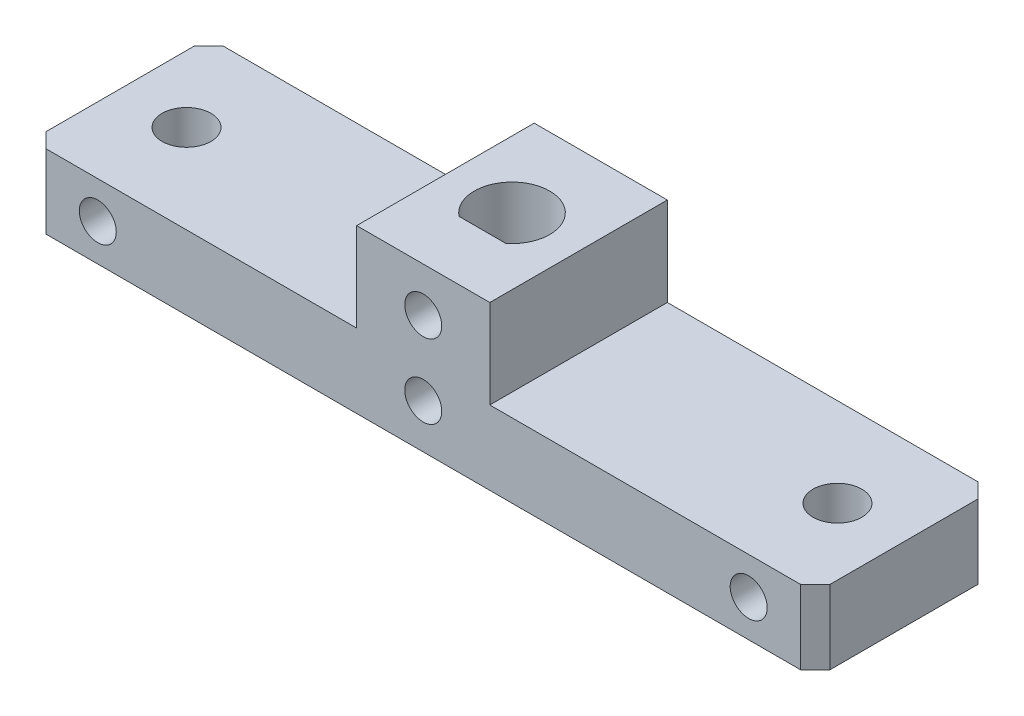
from build123d import *

# Parameters (mm, degrees)
BODY_EXTRUDE_DEPTH               = 12
PIVOT_M4_HOLES_D                 = 3.3
PIVOT_ACCESS_CUT_DEPTH           = 32.10064308
SET_SCREW_M3_TAPPED_HOLES_REACH  = 33.101
SET_SCREW_M3_TAPPED_HOLES_BORE_R = 1.25
CORNER_CHAMFERS_SIZE             = 1


with BuildPart() as part:
    # Body Sketch → Body Extrude (new body)
    with BuildSketch(Plane.XY):
        Polygon((-26.5, 0), (26.5, 0), (26.5, 5), (4.5, 5), (4.5, 11), (-4.5, 11), (-4.5, 5), (-26.5, 5), align=None)
    extrude(amount=-BODY_EXTRUDE_DEPTH)

    # Pivot M4 Holes (through all)
    with Locations(Plane.XZ):
        with Locations((-22, -6), (22, -6)):
            Hole(PIVOT_M4_HOLES_D / 2)

    # Sketch2 → Pivot Access Cut (cut, through all)
    with BuildSketch(Plane(origin=(0, 0, 0), x_dir=(1, 0, 0), z_dir=(0, 1, 0))):
        with BuildLine():
            Line((-1.581929202, 4), (1.581929202, 4))
            ThreePointArc((1.581929202, 4), (0, 8.55), (-1.581929202, 4))
        make_face()
    extrude(amount=PIVOT_ACCESS_CUT_DEPTH, mode=Mode.SUBTRACT)

    # Set Screw M3 Tapped Holes bore → Set Screw M3 Tapped Holes (cut, up to next)
    with BuildSketch(Plane.XY, mode=Mode.PRIVATE) as set_screw_m3_tapped_holes_sk1:
        with Locations((-22, 2.5)):
            Circle(SET_SCREW_M3_TAPPED_HOLES_BORE_R)
    set_screw_m3_tapped_holes_tool1 = extrude(set_screw_m3_tapped_holes_sk1.sketch, amount=-SET_SCREW_M3_TAPPED_HOLES_REACH, mode=Mode.PRIVATE) & part.part
    # Set Screw M3 Tapped Holes bore → Set Screw M3 Tapped Holes (cut, up to next)
    with BuildSketch(Plane.XY, mode=Mode.PRIVATE) as set_screw_m3_tapped_holes_sk2:
        with Locations((22, 2.5)):
            Circle(SET_SCREW_M3_TAPPED_HOLES_BORE_R)
    set_screw_m3_tapped_holes_tool2 = extrude(set_screw_m3_tapped_holes_sk2.sketch, amount=-SET_SCREW_M3_TAPPED_HOLES_REACH, mode=Mode.PRIVATE) & part.part
    # Set Screw M3 Tapped Holes bore → Set Screw M3 Tapped Holes (cut, up to next)
    with BuildSketch(Plane.XY, mode=Mode.PRIVATE) as set_screw_m3_tapped_holes_sk3:
        with Locations((0, 8)):
            Circle(SET_SCREW_M3_TAPPED_HOLES_BORE_R)
    set_screw_m3_tapped_holes_tool3 = extrude(set_screw_m3_tapped_holes_sk3.sketch, amount=-SET_SCREW_M3_TAPPED_HOLES_REACH, mode=Mode.PRIVATE) & part.part
    # Set Screw M3 Tapped Holes bore → Set Screw M3 Tapped Holes (cut, up to next)
    with BuildSketch(Plane.XY, mode=Mode.PRIVATE) as set_screw_m3_tapped_holes_sk4:
        with Locations((0, 3)):
            Circle(SET_SCREW_M3_TAPPED_HOLES_BORE_R)
    set_screw_m3_tapped_holes_tool4 = extrude(set_screw_m3_tapped_holes_sk4.sketch, amount=-SET_SCREW_M3_TAPPED_HOLES_REACH, mode=Mode.PRIVATE) & part.part
    add(set_screw_m3_tapped_holes_tool1.solids().sort_by_distance((-22, 2.5, 0))[0], mode=Mode.SUBTRACT)
    add(set_screw_m3_tapped_holes_tool2.solids().sort_by_distance((22, 2.5, 0))[0], mode=Mode.SUBTRACT)
    add(set_screw_m3_tapped_holes_tool3.solids().sort_by_distance((0, 8, 0))[0], mode=Mode.SUBTRACT)
    add(set_screw_m3_tapped_holes_tool4.solids().sort_by_distance((0, 3, 0))[0], mode=Mode.SUBTRACT)

    # Corner Chamfers
    corner_chamfers_edges = [part.edges().sort_by_distance(p)[0] for p in [
        (26.5, 2.5, 0),
        (-26.5, 2.5, 0),
        (26.5, 2.5, -12),
        (-26.5, 2.5, -12),
    ]]
    chamfer(corner_chamfers_edges, length=CORNER_CHAMFERS_SIZE)


solid = part.part
